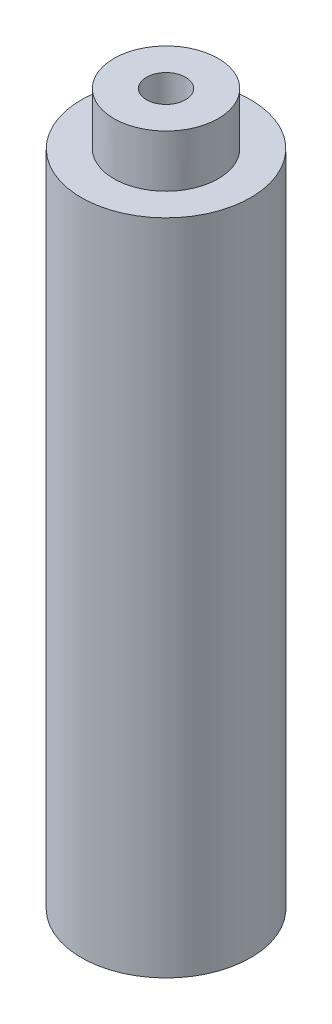
from build123d import *
from build123d.topology import SkipClean

# Parameters (mm, degrees)
SKETCH1_R           = 2
SKETCH1_R_2         = 0.75
BOSS_EXTRUDE1_DEPTH = 2
BOSS_EXTRUDE2_START = 0.25
SKETCH2_R           = 3.25
SKETCH2_R_2         = 0.75
BOSS_EXTRUDE2_DEPTH = 0.25
BOSS_EXTRUDE3_START = 25
SKETCH3_R           = 3.25
SKETCH3_R_2         = 3
BOSS_EXTRUDE3_DEPTH = 25


with BuildPart() as part:
    # Sketch1 → Boss-Extrude1 (new body)
    with BuildSketch(Plane(origin=(0, 0, 0), x_dir=(1, 0, 0), z_dir=(0, 1, 0))):
        with Locations(Location((0, 0, 0), (0, 0, 270))):
            Circle(SKETCH1_R)
        with Locations(Location((0, 0, 0), (0, 0, 270))):
            Circle(SKETCH1_R_2, mode=Mode.SUBTRACT)
    extrude(amount=BOSS_EXTRUDE1_DEPTH)

    # Sketch2 → Boss-Extrude2 (add)
    with SkipClean():  # the faces are left unmerged after this step: merging them gives an invalid solid
        with BuildSketch(Plane.XZ.offset(BOSS_EXTRUDE2_START)):
            with Locations(Location((0, 0, 0), (0, 0, 270))):
                Circle(SKETCH2_R)
            with Locations(Location((0, 0, 0), (0, 0, 270))):
                Circle(SKETCH2_R_2, mode=Mode.SUBTRACT)
        extrude(amount=-BOSS_EXTRUDE2_DEPTH)

    # Sketch3 → Boss-Extrude3 (add)
    with SkipClean():  # the faces are left unmerged after this step: merging them gives an invalid solid
        with BuildSketch(Plane.XZ.offset(0.25).offset(BOSS_EXTRUDE3_START)):
            with Locations(Location((0, 0, 0), (0, 0, 270))):
                Circle(SKETCH3_R)
            with Locations(Location((0, 0, 0), (0, 0, 270))):
                Circle(SKETCH3_R_2, mode=Mode.SUBTRACT)
        extrude(amount=-BOSS_EXTRUDE3_DEPTH)


solid = part.part
